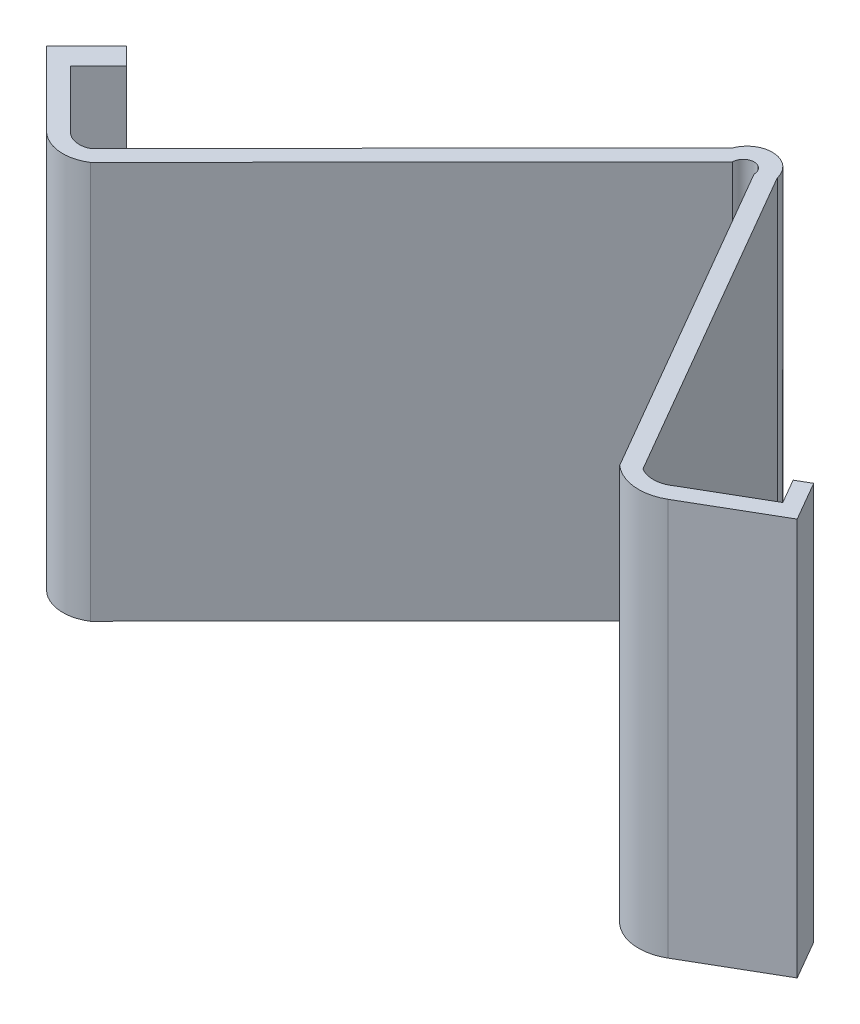
from build123d import *

# Parameters (mm, degrees)
EXTRUDE_1_DEPTH = 70


with BuildPart() as part:
    # 草圖1 → 填料-伸長1 (new body)
    with BuildSketch(Plane(origin=(0, 0, 0), x_dir=(1, 0, 0), z_dir=(0, 1, 0))):
        with BuildLine():
            Line((10.996587269, 18.037741282), (-45.487838574, -38.61479297))
            ThreePointArc((-45.487838574, -38.61479297), (-47.84934361, -38.895811815), (-49.888582931, -37.672218494))
            Line((-49.888582931, -37.672218494), (-59.802776425, -27.787443971))
            Line((-59.802776425, -27.787443971), (-54.860389164, -22.830347224))
            Line((-54.860389164, -22.830347224), (-57.919724227, -19.780090306))
            Line((-57.919724227, -19.780090306), (-64.980277457, -26.861657088))
            Line((-64.980277457, -26.861657088), (-52.0067489, -39.796688528))
            ThreePointArc((-52.0067489, -39.796688528), (-47.849605549, -41.783872953), (-43.363368539, -40.732958939))
            Line((-43.363368539, -40.732958939), (13.121057303, 15.919575313))
            ThreePointArc((13.121057303, 15.919575313), (15.009846467, 17.808364477), (16.898635631, 15.919575313))
            Line((16.898635631, 15.919575313), (49.482242531, -40.323722611))
            ThreePointArc((49.482242531, -40.323722611), (54.046060411, -42.29505362), (58.903884757, -41.238586769))
            Line((58.903884757, -41.238586769), (73.314668888, -32.889941818))
            Line((73.314668888, -32.889941818), (69.304378808, -25.967689766))
            Line((69.304378808, -25.967689766), (67.007535769, -27.298327077))
            Line((67.007535769, -27.298327077), (69.513967069, -31.624734609))
            Line((69.513967069, -31.624734609), (57.400025977, -38.642742249))
            ThreePointArc((57.400025977, -38.642742249), (54.765652782, -39.530436118), (52.078087051, -38.819863831))
            Line((52.078087051, -38.819863831), (19.494480151, 17.423434093))
            ThreePointArc((19.494480151, 17.423434093), (15.47366289, 20.886366054), (10.996587269, 18.037741282))
        make_face()
    extrude(amount=EXTRUDE_1_DEPTH)


solid = part.part
